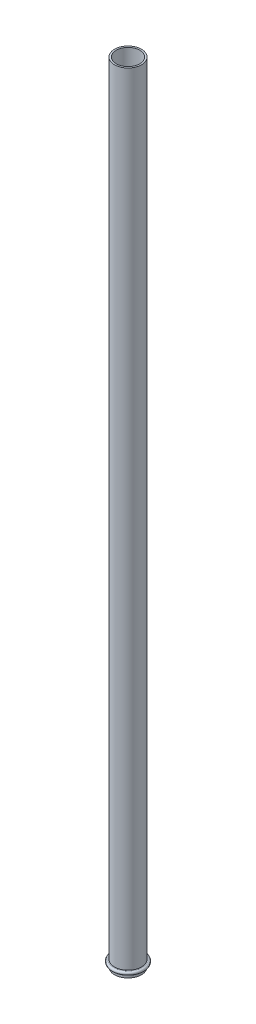
from build123d import *

# Parameters (mm, degrees)
SKETCH1_R           = 8
SKETCH1_R_2         = 7
BOSS_EXTRUDE1_DEPTH = 467.66
SCALE1_SCALE        = 0.857142857


with BuildPart() as part:
    # Sketch1 → Boss-Extrude1 (new body)
    with BuildSketch(Plane(origin=(0, 0, 0), x_dir=(1, 0, 0), z_dir=(0, 1, 0))):
        with Locations(Location((0, 0, 0), (0, 0, 270))):
            Circle(SKETCH1_R)
        with Locations(Location((0, 0, 0), (0, 0, 270))):
            Circle(SKETCH1_R_2, mode=Mode.SUBTRACT)
    extrude(amount=BOSS_EXTRUDE1_DEPTH)

    # Sketch2 → Revolve1 (revolve)
    with BuildSketch(Plane.XY, mode=Mode.PRIVATE) as revolve1_sk:
        with BuildLine():
            Line((8, 2), (8.5, 2))
            ThreePointArc((8.5, 2), (9.5, 3), (8.5, 4))
            Line((8.5, 4), (8, 4))
            Line((8, 4), (8, 2))
        make_face()
    revolve(revolve1_sk.sketch.rotate(Axis((0, 0, 0), (0, 1, 0)), 90), axis=Axis((0, 0, 0), (0, 1, 0)))


with BuildPart() as part_1:
    # Scale1: scaled about (0, 232.373730032, 0)
    add(part.part.scale(SCALE1_SCALE).moved(Location((0, 33.196247147, 0))))


solid = part_1.part
